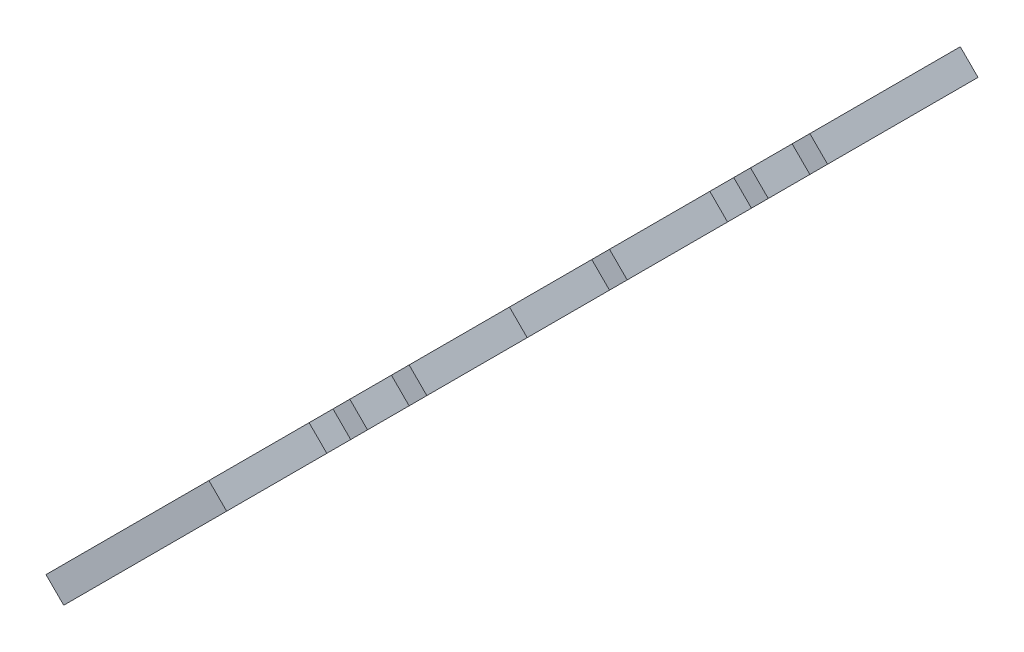
from build123d import *

# Parameters (mm, degrees)
BOSS_EXTRUDE1_DEPTH = 190.5
SKETCH2_W           = 25.35879418
SKETCH2_H           = 6.35
CUT_EXTRUDE1_DEPTH  = 6.35
LPATTERN1_COUNT     = 3
LPATTERN1_PITCH     = 50.8
BOSS_EXTRUDE2_DEPTH = 6.35
SKETCH5_R           = 2.0955
CUT_EXTRUDE2_DEPTH  = 206.304109574
CUT_EXTRUDE3_DEPTH  = 206.304109574


with BuildPart() as part:
    # Sketch1 → Boss-Extrude1 (new body)
    with BuildSketch(Plane.XY):
        Polygon((-108.212086259, 4.54079067), (-66.902908102, 45.849968827), (-71.393036163, 50.340096887), (-112.702214319, 9.030918731), align=None)
    extrude(amount=BOSS_EXTRUDE1_DEPTH)

    # Sketch2 → Cut-Extrude1 (cut)
    with BuildSketch(Plane(origin=(-60.866566525, 60.866566525, 0), x_dir=(0, 0, 1), z_dir=(-0.7071067811865477, 0.7071067811865474, 0))):
        with Locations((152.42060291, -18.061676125)):
            Rectangle(SKETCH2_W, SKETCH2_H)
        with Locations((152.42060291, -70.131676125)):
            Rectangle(SKETCH2_W, SKETCH2_H)
    cut_extrude1 = extrude(amount=-CUT_EXTRUDE1_DEPTH, mode=Mode.SUBTRACT)

    # LPattern1: Cut-Extrude1 ×3
    with Locations(*[(0, 0, -i * LPATTERN1_PITCH) for i in range(1, LPATTERN1_COUNT)]):
        add(cut_extrude1, mode=Mode.SUBTRACT)

    # Sketch3 → Boss-Extrude2 (add)
    with BuildSketch(Plane(origin=(0, 0, 0), x_dir=(-1, 0, 0), z_dir=(0, 0, -1))):
        Polygon((92.496638047, 20.256238882), (96.986766108, 24.746366942), (88.006509986, 33.726623063), (83.419538791, 29.333338138), align=None)
    extrude(amount=BOSS_EXTRUDE2_DEPTH)

    # Sketch5 → Cut-Extrude2 (cut, through all)
    with BuildSketch(Plane(origin=(-56.376438464, 56.376438464, 0), x_dir=(0, 0, -1), z_dir=(0.7071067811865477, -0.7071067811865474, 0))):
        with Locations(Location((-177.8, -70.131676125, 0), (0, 0, 90))):
            Circle(SKETCH5_R)
        with Locations(Location((-76.2, -70.131676125, 0), (0, 0, 90))):
            Circle(SKETCH5_R)
        with Locations(Location((-15.875, -70.131676125, 0), (0, 0, 90))):
            Circle(SKETCH5_R)
    cut_extrude2 = extrude(amount=-CUT_EXTRUDE2_DEPTH, mode=Mode.SUBTRACT)

    # Mirror1: Cut-Extrude2 across plane
    add(cut_extrude2.mirror(Plane(origin=(-31.181058716, -31.181058716, 0), x_dir=(0, 0, 1), z_dir=(-0.7071067811865475, -0.7071067811865477, 0))), mode=Mode.SUBTRACT)

    # Sketch6 → Cut-Extrude3 (cut, through all)
    with BuildSketch(Plane(origin=(-60.866566525, 60.866566525, 0), x_dir=(0, 0, 1), z_dir=(-0.7071067811865477, 0.7071067811865475, 0))):
        Polygon((52.95420291, -21.236676125), (48.68700291, -21.236676125), (48.68700291, -29.999676125), (46.37560291, -29.999676125), (46.37560291, -33.174676125), (48.68700291, -33.174676125), (48.68700291, -36.476676125), (52.95420291, -36.476676125), (52.95420291, -33.174676125), (55.26560291, -33.174676125), (55.26560291, -29.999676125), (52.95420291, -29.999676125), align=None)
        Polygon((154.55420291, -21.236676125), (150.28700291, -21.236676125), (150.28700291, -29.999676125), (147.97560291, -29.999676125), (147.97560291, -33.174676125), (150.28700291, -33.174676125), (150.28700291, -36.476676125), (154.55420291, -36.476676125), (154.55420291, -33.174676125), (156.86560291, -33.174676125), (156.86560291, -29.999676125), (154.55420291, -29.999676125), align=None)
    cut_extrude3 = extrude(amount=-CUT_EXTRUDE3_DEPTH, mode=Mode.SUBTRACT)

    # Mirror2: Cut-Extrude3 across plane
    add(cut_extrude3.mirror(Plane(origin=(-31.181058716, -31.181058716, 0), x_dir=(0, 0, 1), z_dir=(-0.7071067811865475, -0.7071067811865477, 0))), mode=Mode.SUBTRACT)


solid = part.part
